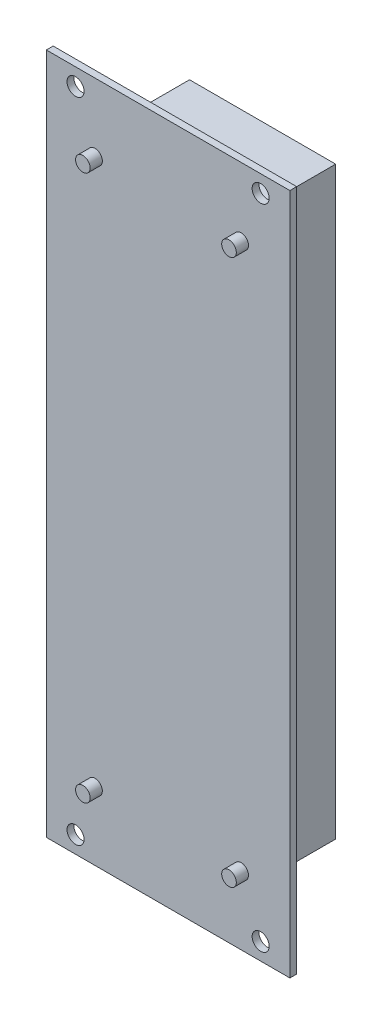
from build123d import *

# Parameters (mm, degrees)
SKETCH1_W           = 50
SKETCH1_H           = 140
BOSS_EXTRUDE1_DEPTH = 0.7
SKETCH3_W           = 30
SKETCH3_H           = 120
BOSS_EXTRUDE2_DEPTH = 18
SKETCH4_R           = 1.75
CUT_EXTRUDE1_DEPTH  = 1.4
SKETCH5_R           = 1.5
BOSS_EXTRUDE3_DEPTH = 2.5


with BuildPart() as part:
    # Sketch1 → Boss-Extrude1 (new, symmetric)
    with BuildSketch(Plane.XY):
        Rectangle(SKETCH1_W, SKETCH1_H)
    extrude(amount=BOSS_EXTRUDE1_DEPTH, both=True)

    # Sketch3 → Boss-Extrude2 (add)
    with BuildSketch(Plane(origin=(0, 0, -0.7), x_dir=(-1, 0, 0), z_dir=(0, 0, -1))):
        Rectangle(SKETCH3_W, SKETCH3_H)
    extrude(amount=BOSS_EXTRUDE2_DEPTH)

    # Sketch4 → Cut-Extrude1 (cut)
    with BuildSketch(Plane(origin=(0, 0, -0.7), x_dir=(-1, 0, 0), z_dir=(0, 0, -1))):
        with Locations((-19, 66.5)):
            Circle(SKETCH4_R)
        with Locations((19, 66.5)):
            Circle(SKETCH4_R)
        with Locations((-19, -66.5)):
            Circle(SKETCH4_R)
        with Locations((19, -66.5)):
            Circle(SKETCH4_R)
    extrude(amount=-CUT_EXTRUDE1_DEPTH, mode=Mode.SUBTRACT)

    # Sketch5 → Boss-Extrude3 (add)
    with BuildSketch(Plane.XY.offset(0.7)):
        with Locations(Location((15, 56, 0), (0, 0, 180))):
            Circle(SKETCH5_R)
        with Locations(Location((-15, 56, 0), (0, 0, 180))):
            Circle(SKETCH5_R)
        with Locations(Location((-15, -56, 0), (0, 0, 180))):
            Circle(SKETCH5_R)
        with Locations(Location((15, -56, 0), (0, 0, 180))):
            Circle(SKETCH5_R)
    extrude(amount=BOSS_EXTRUDE3_DEPTH)


solid = part.part
